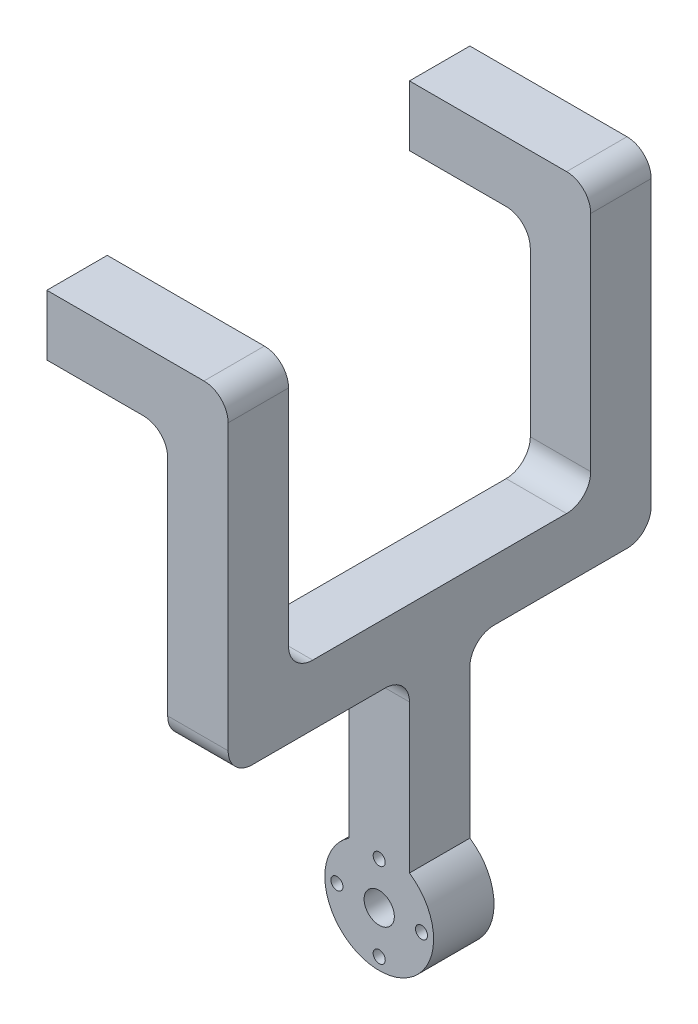
from build123d import *

# Parameters (mm, degrees)
ESQUISSE1_R        = 2.5
ESQUISSE1_R_2      = 1
BOSS_EXTRU_1_DEPTH = 10
BOSS_EXTRU_2_DEPTH = 10
ESQUISSE5_W        = 10
ESQUISSE5_H        = 10
BOSS_EXTRU_3_DEPTH = 20
CONG_1_R           = 4


with BuildPart() as part:
    # Esquisse1 → Boss.-Extru.1 (new body)
    with BuildSketch(Plane.XY):
        with BuildLine():
            Line((4, 55), (14, 55))
            Line((14, 55), (14, 16.483314774))
            ThreePointArc((14, 16.483314774), (9, 0), (4, 16.483314774))
            Line((4, 16.483314774), (4, 55))
        make_face()
        with Locations((9, 9)):
            Circle(ESQUISSE1_R, mode=Mode.SUBTRACT)
        with Locations((9, 16)):
            Circle(ESQUISSE1_R_2, mode=Mode.SUBTRACT)
        with Locations((16, 9)):
            Circle(ESQUISSE1_R_2, mode=Mode.SUBTRACT)
        with Locations((9, 2)):
            Circle(ESQUISSE1_R_2, mode=Mode.SUBTRACT)
        with Locations((2, 9)):
            Circle(ESQUISSE1_R_2, mode=Mode.SUBTRACT)
    extrude(amount=BOSS_EXTRU_1_DEPTH)

    # Esquisse4 → Boss.-Extru.2 (add)
    with BuildSketch(Plane(origin=(14, 0, 0), x_dir=(0, 0, -1), z_dir=(1, 0, 0))):
        Polygon((-30, 55), (20, 55), (20, 100), (30, 100), (30, 45), (-40, 45), (-40, 100), (-30, 100), align=None)
    extrude(amount=-BOSS_EXTRU_2_DEPTH)

    # Esquisse5 → Boss.-Extru.3 (add)
    with BuildSketch(Plane.ZY.offset(-4)):
        with Locations((-25, 95)):
            Rectangle(ESQUISSE5_W, ESQUISSE5_H)
        with Locations((35, 95)):
            Rectangle(ESQUISSE5_W, ESQUISSE5_H)
    extrude(amount=BOSS_EXTRU_3_DEPTH)

    # Congé1
    cong_1_edges = [part.edges().sort_by_distance(p)[0] for p in [
        (9, 45, 0),
        (9, 45, -30),
        (14, 100, -25),
        (9, 55, -20),
        (9, 45, 10),
        (9, 45, 40),
        (9, 55, 30),
        (14, 100, 35),
        (4, 90, -25),
        (4, 90, 35),
    ]]
    fillet(cong_1_edges, radius=CONG_1_R)


solid = part.part
